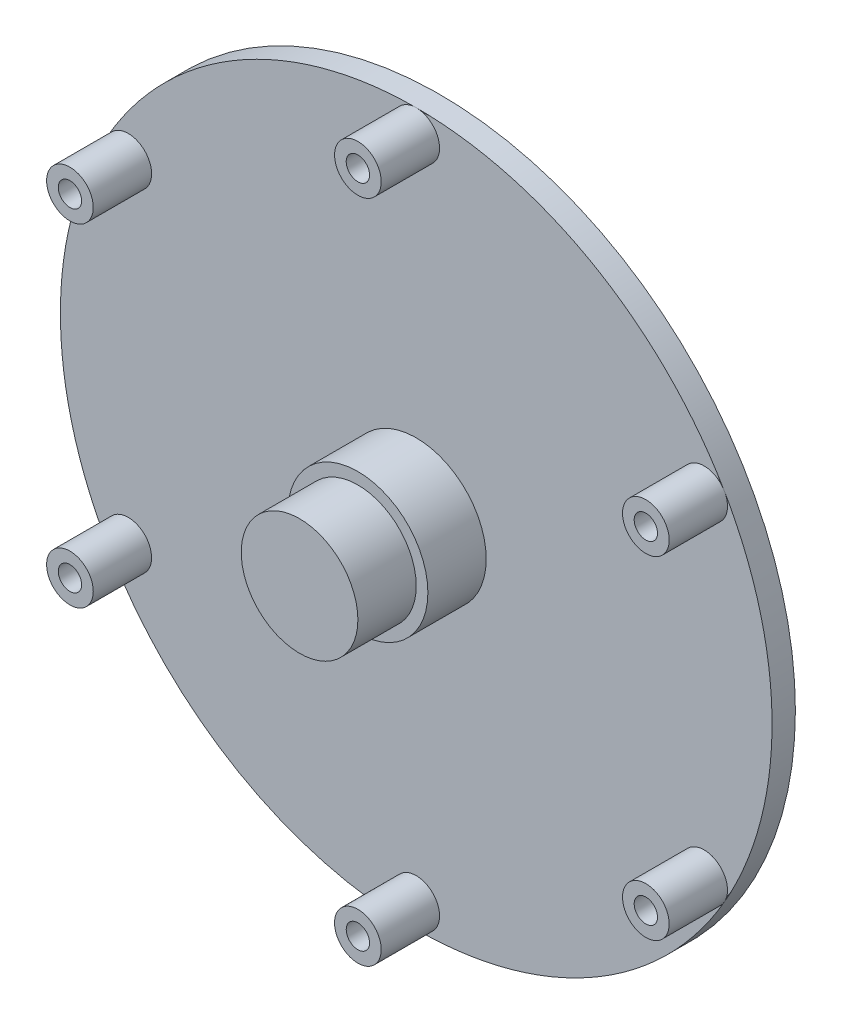
from build123d import *

# Parameters (mm, degrees)
SKETCH_1_R               = 30.5
EXTRUDE_1_DEPTH          = 2
SKETCH_2_R               = 1
EXTRUDE_2_DEPTH          = 1.5
PATTERN_CIRCULAR_1_COUNT = 6
EXTRUDE_3_DEPTH          = 10
EXTRUDE_3_DEPTH_BACK     = 20
SKETCH_3_R               = 5
SKETCH_4_R               = 2
SKETCH_4_R_2             = 1
EXTRUDE_1_2_DEPTH        = 5
PATTERN_CIRCULAR_3_COUNT = 6
SKETCH_5_R               = 6
EXTRUDE_5_DEPTH          = 1
EXTRUDE_START            = 5
SKETCH_6_R               = 6
EXTRUDE_6_DEPTH          = 5
SKETCH_7_R               = 3
CUT_EXTRUDE_1_DEPTH      = 8


with BuildPart() as part:
    # 草图1 → Extrude 1 (new body)
    with BuildSketch(Plane.XY):
        Circle(SKETCH_1_R)
    extrude(amount=EXTRUDE_1_DEPTH)

    # 草图2 → 凸台-拉伸2 (add)
    with BuildSketch(Plane.XY.offset(2)):
        with Locations((0, 28.5)):
            Circle(SKETCH_2_R)
    extrude_2 = extrude(amount=EXTRUDE_2_DEPTH)

    # 阵列(圆周)1: 凸台-拉伸2 ×6 about axis
    pattern_circular_1_axis = Axis((0, 0, 0), (0, 0, 1))
    for i in range(1, PATTERN_CIRCULAR_1_COUNT):
        add(extrude_2.rotate(pattern_circular_1_axis, i * 360 / PATTERN_CIRCULAR_1_COUNT))

    # 草图3 → 凸台-拉伸3 (add, two sides: drawn at the far end of the back side and taken through both)
    with BuildSketch(Plane.XY.offset(2).offset(-EXTRUDE_3_DEPTH_BACK)):
        Circle(SKETCH_3_R)
    extrude(amount=EXTRUDE_3_DEPTH + EXTRUDE_3_DEPTH_BACK)

    # 草图4 → Extrude 1 2 (add)
    with BuildSketch(Plane.XY.offset(2)):
        with Locations((0, 28.5)):
            Circle(SKETCH_4_R)
        with Locations((0, 28.5)):
            Circle(SKETCH_4_R_2, mode=Mode.SUBTRACT)
    extrude_1_2 = extrude(amount=EXTRUDE_1_2_DEPTH)

    # 阵列(圆周)3: Extrude 1 2 ×6 about axis
    pattern_circular_3_axis = Axis((0, 0, 0), (0, 0, 1))
    for i in range(1, PATTERN_CIRCULAR_3_COUNT):
        add(extrude_1_2.rotate(pattern_circular_3_axis, i * 360 / PATTERN_CIRCULAR_3_COUNT))

    # 草图5 → 凸台-拉伸5 (add)
    with BuildSketch(Plane(origin=(0, 0, 0), x_dir=(-1, 0, 0), z_dir=(0, 0, -1))):
        with Locations(Location((0, 0, 0), (0, 0, 180))):
            Circle(SKETCH_5_R)
    extrude(amount=EXTRUDE_5_DEPTH)

    # 草图6 → 凸台-拉伸6 (add)
    with BuildSketch(Plane.XY.offset(2).offset(EXTRUDE_START)):
        Circle(SKETCH_6_R)
    extrude(amount=-EXTRUDE_6_DEPTH)

    # 草图7 → 切除-拉伸1 (cut)
    with BuildSketch(Plane(origin=(0, 0, -18), x_dir=(-1, 0, 0), z_dir=(0, 0, -1))):
        Circle(SKETCH_7_R)
    extrude(amount=-CUT_EXTRUDE_1_DEPTH, mode=Mode.SUBTRACT)


solid = part.part
